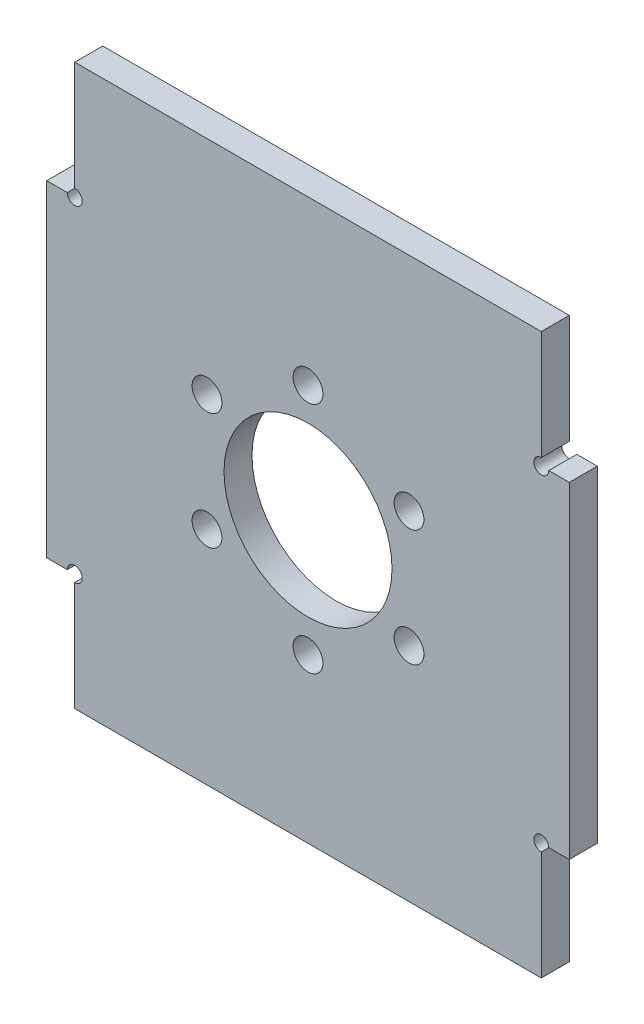
from build123d import *

# Parameters (mm, degrees)
SKETCH1_W           = 50
SKETCH1_H           = 60
SKETCH1_R           = 1.6
SKETCH1_R_2         = 9
BOSS_EXTRUDE1_DEPTH = 3
SKETCH2_W           = 6
SKETCH2_H           = 35
BOSS_EXTRUDE2_DEPTH = 3
SKETCH3_R           = 0.8
CUT_EXTRUDE1_DEPTH  = 42.146081223


with BuildPart() as part:
    # Sketch1 → Boss-Extrude1 (new body)
    with BuildSketch(Plane.XY):
        Rectangle(SKETCH1_W, SKETCH1_H)
        with Locations((0, 12.5)):
            Circle(SKETCH1_R, mode=Mode.SUBTRACT)
        with Locations((10.825317547, 6.25)):
            Circle(SKETCH1_R, mode=Mode.SUBTRACT)
        with Locations((10.825317547, -6.25)):
            Circle(SKETCH1_R, mode=Mode.SUBTRACT)
        with Locations((0, -12.5)):
            Circle(SKETCH1_R, mode=Mode.SUBTRACT)
        with Locations((-10.825317547, -6.25)):
            Circle(SKETCH1_R, mode=Mode.SUBTRACT)
        with Locations((-10.825317547, 6.25)):
            Circle(SKETCH1_R, mode=Mode.SUBTRACT)
        Circle(SKETCH1_R_2, mode=Mode.SUBTRACT)
    extrude(amount=BOSS_EXTRUDE1_DEPTH)

    # Sketch2 → Boss-Extrude2 (add)
    with BuildSketch(Plane.XY.offset(3)):
        with Locations((-25, 0)):
            Rectangle(SKETCH2_W, SKETCH2_H)
        with Locations((25, 0)):
            Rectangle(SKETCH2_W, SKETCH2_H)
    extrude(amount=-BOSS_EXTRUDE2_DEPTH)

    # Sketch3 → Cut-Extrude1 (cut, through all)
    with BuildSketch(Plane.XY.offset(3)):
        with Locations((-25, 17.5)):
            Circle(SKETCH3_R)
        with Locations((-25, -17.5)):
            Circle(SKETCH3_R)
        with Locations((25, 17.5)):
            Circle(SKETCH3_R)
        with Locations((25, -17.5)):
            Circle(SKETCH3_R)
    extrude(amount=-CUT_EXTRUDE1_DEPTH, mode=Mode.SUBTRACT)


solid = part.part
